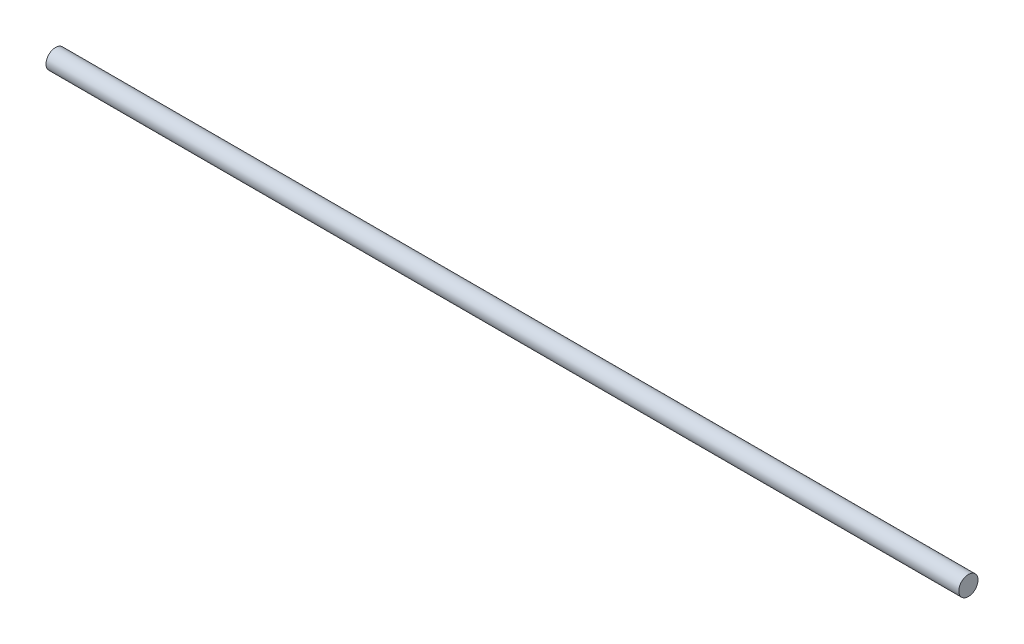
from build123d import *

# Parameters (mm, degrees)
SKETCH1_R           = 12.7
BOSS_EXTRUDE1_DEPTH = 1206.5


with BuildPart() as part:
    # Sketch1 → Boss-Extrude1 (new body)
    with BuildSketch(Plane(origin=(0, 0, 0), x_dir=(0, 0, -1), z_dir=(1, 0, 0))):
        Circle(SKETCH1_R)
    extrude(amount=BOSS_EXTRUDE1_DEPTH)


solid = part.part
